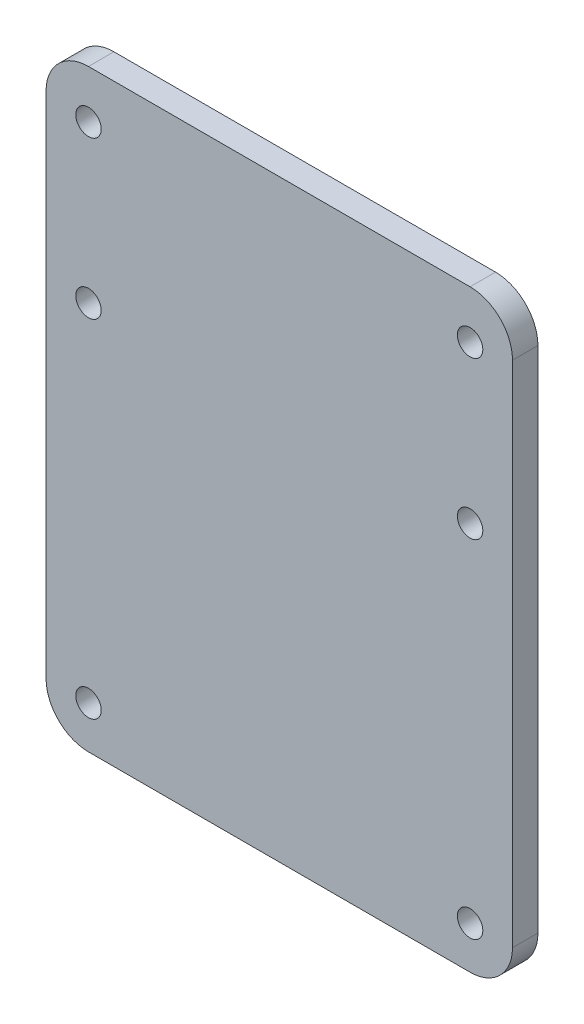
from build123d import *

# Parameters (mm, degrees)
SKETCH1_W           = 55
SKETCH1_H           = 70
BOSS_EXTRUDE1_DEPTH = 3
SKETCH2_R           = 1.5
CUT_EXTRUDE1_DEPTH  = 3
FILLET1_R           = 5


with BuildPart() as part:
    # Sketch1 → Boss-Extrude1 (new body)
    with BuildSketch(Plane.XY):
        with Locations((1.762820513, 7.248931624)):
            Rectangle(SKETCH1_W, SKETCH1_H)
    extrude(amount=BOSS_EXTRUDE1_DEPTH)

    # Sketch2 → Cut-Extrude1 (cut)
    with BuildSketch(Plane.XY.offset(3)):
        with Locations((-20.737179487, 36.587967336)):
            Circle(SKETCH2_R)
        with Locations((24.262820513, 36.587967336)):
            Circle(SKETCH2_R)
        with Locations((-20.737179487, 18.087967336)):
            Circle(SKETCH2_R)
        with Locations((24.262820513, 18.087967336)):
            Circle(SKETCH2_R)
        with Locations((-20.737179487, -22.751068376)):
            Circle(SKETCH2_R)
        with Locations((24.262820513, -22.751068376)):
            Circle(SKETCH2_R)
    extrude(amount=-CUT_EXTRUDE1_DEPTH, mode=Mode.SUBTRACT)

    # Fillet1
    fillet1_edges = [part.edges().sort_by_distance(p)[0] for p in [
        (-25.737179487, 42.248931624, 1.5),
        (29.262820513, 42.248931624, 1.5),
        (29.262820513, -27.751068376, 1.5),
        (-25.737179487, -27.751068376, 1.5),
    ]]
    fillet(fillet1_edges, radius=FILLET1_R)


solid = part.part
